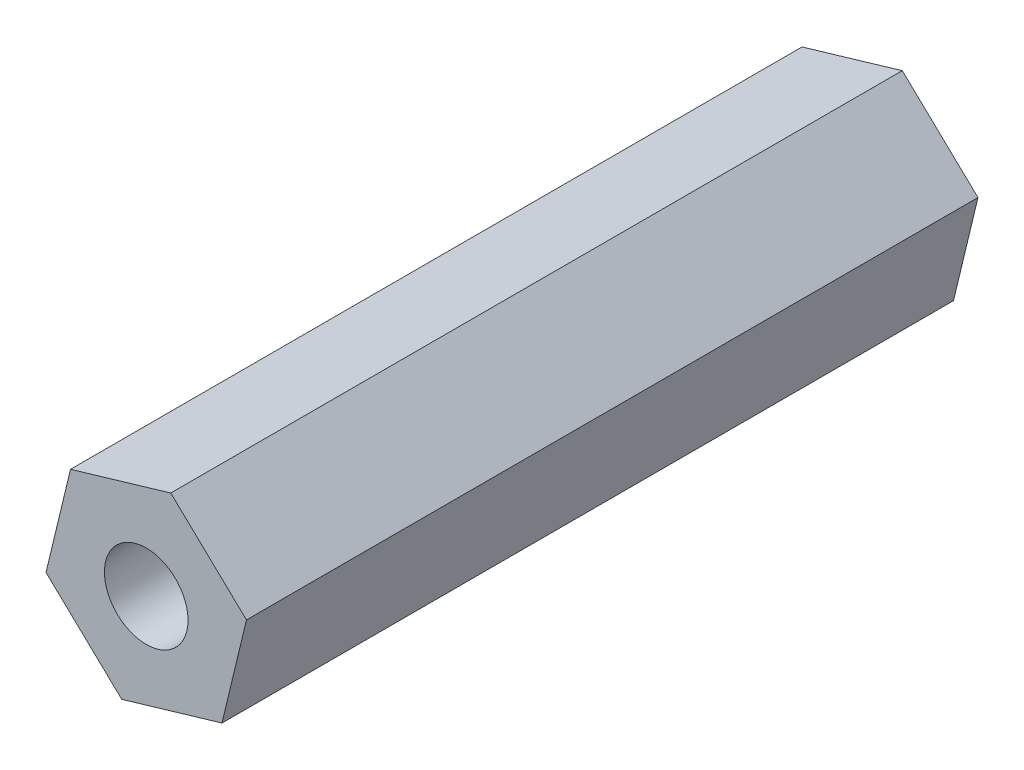
from build123d import *

# Parameters (mm, degrees)
EXTRUDE_1_DEPTH     = 28
SKETCH_2_R          = 1.6
CUT_EXTRUDE_1_DEPTH = 48


with BuildPart() as part:
    # 草图1 → 凸台-拉伸1 (new body)
    with BuildSketch(Plane.XY):
        Polygon((2.898494128, -2.756579727), (3.836515135, 1.131879684), (0.938021007, 3.888459411), (-2.898494128, 2.756579727), (-3.836515135, -1.131879684), (-0.938021007, -3.888459411), align=None)
    extrude(amount=EXTRUDE_1_DEPTH)

    # 草图2 → 切除-拉伸1 (cut)
    with BuildSketch(Plane.XY):
        Circle(SKETCH_2_R)
    extrude(amount=CUT_EXTRUDE_1_DEPTH, mode=Mode.SUBTRACT)


solid = part.part
